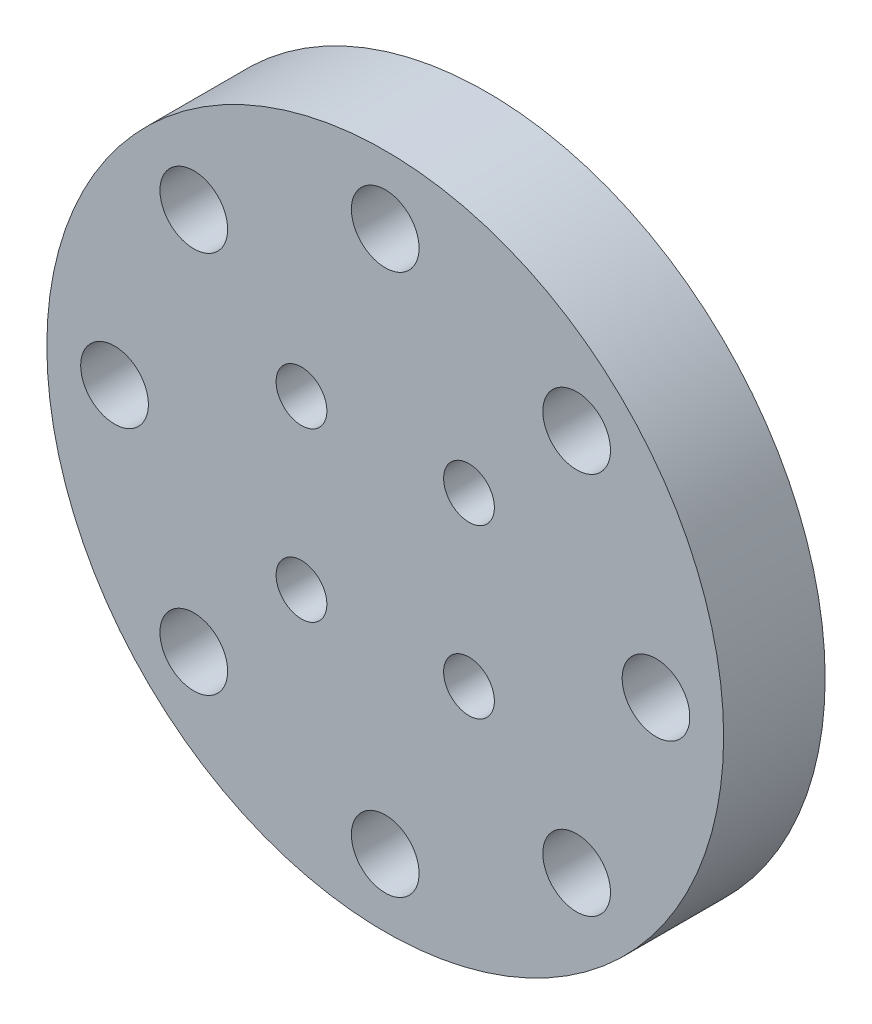
from build123d import *

# Parameters (mm, degrees)
SKETCH1_R           = 20
BOSS_EXTRUDE1_DEPTH = 6
SKETCH2_R           = 2
SKETCH2_R_2         = 1.5
CUT_EXTRUDE1_DEPTH  = 6
SKETCH4_R           = 3
CUT_EXTRUDE2_DEPTH  = 3.1


with BuildPart() as part:
    # Sketch1 → Boss-Extrude1 (new body)
    with BuildSketch(Plane.XY):
        Circle(SKETCH1_R)
    extrude(amount=BOSS_EXTRUDE1_DEPTH)

    # Sketch2 → Cut-Extrude1 (cut)
    with BuildSketch(Plane(origin=(0, 0, 0), x_dir=(-1, 0, 0), z_dir=(0, 0, -1))):
        with Locations((0, 16)):
            Circle(SKETCH2_R)
        with Locations((11.313708499, 11.313708499)):
            Circle(SKETCH2_R)
        with Locations((16, 0)):
            Circle(SKETCH2_R)
        with Locations((11.313708499, -11.313708499)):
            Circle(SKETCH2_R)
        with Locations((0, -16)):
            Circle(SKETCH2_R)
        with Locations((-11.313708499, -11.313708499)):
            Circle(SKETCH2_R)
        with Locations((-16, 0)):
            Circle(SKETCH2_R)
        with Locations((-11.313708499, 11.313708499)):
            Circle(SKETCH2_R)
        with Locations((-4.949747468, -4.949747468)):
            Circle(SKETCH2_R_2)
        with Locations((-4.949747468, 4.949747468)):
            Circle(SKETCH2_R_2)
        with Locations((4.949747468, 4.949747468)):
            Circle(SKETCH2_R_2)
        with Locations((4.949747468, -4.949747468)):
            Circle(SKETCH2_R_2)
    extrude(amount=-CUT_EXTRUDE1_DEPTH, mode=Mode.SUBTRACT)

    # Sketch4 → Cut-Extrude2 (cut)
    with BuildSketch(Plane(origin=(0, 0, 0), x_dir=(-1, 0, 0), z_dir=(0, 0, -1))):
        with Locations((-4.949747468, 4.949747468)):
            Circle(SKETCH4_R)
        with Locations((4.949747468, 4.949747468)):
            Circle(SKETCH4_R)
        with Locations((4.949747468, -4.949747468)):
            Circle(SKETCH4_R)
        with Locations((-4.949747468, -4.949747468)):
            Circle(SKETCH4_R)
    extrude(amount=-CUT_EXTRUDE2_DEPTH, mode=Mode.SUBTRACT)


solid = part.part
